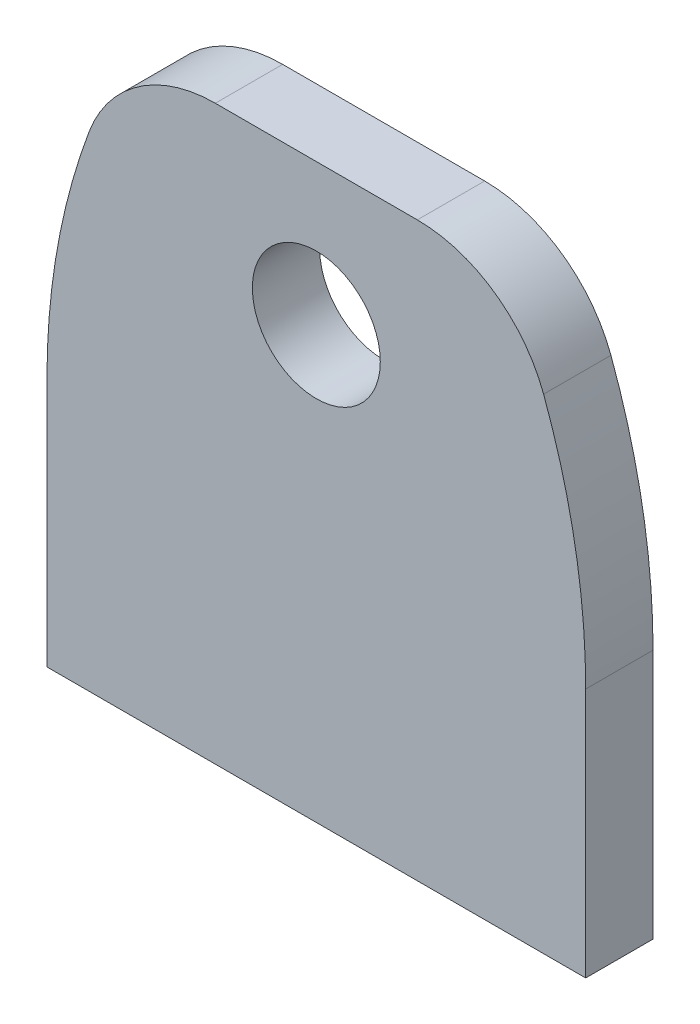
from build123d import *

# Parameters (mm, degrees)
BOSS_EXTRU_1_DEPTH = 10
D_GAGEMENT_M41_D   = 19


with BuildPart() as part:
    # Esquisse1 → Boss.-Extru.1 (new body)
    with BuildSketch(Plane.XY):
        with BuildLine():
            Line((0, 0), (0, 37.161178186))
            ThreePointArc((0, 37.161178186), (1.574901575, 54.838847716), (6.25, 71.959705454))
            ThreePointArc((6.25, 71.959705454), (13.580589093, 81.419410907), (25, 85))
            Line((25, 85), (55, 85))
            ThreePointArc((55, 85), (66.419410907, 81.419410907), (73.75, 71.959705454))
            ThreePointArc((73.75, 71.959705454), (78.425098425, 54.838847716), (80, 37.161178186))
            Line((80, 37.161178186), (80, 0))
            Line((80, 0), (0, 0))
        make_face()
    extrude(amount=BOSS_EXTRU_1_DEPTH)

    # Dégagement M41 (through all)
    with Locations(Plane.XY.offset(10)):
        with Locations((40, 64)):
            Hole(D_GAGEMENT_M41_D / 2)


solid = part.part
